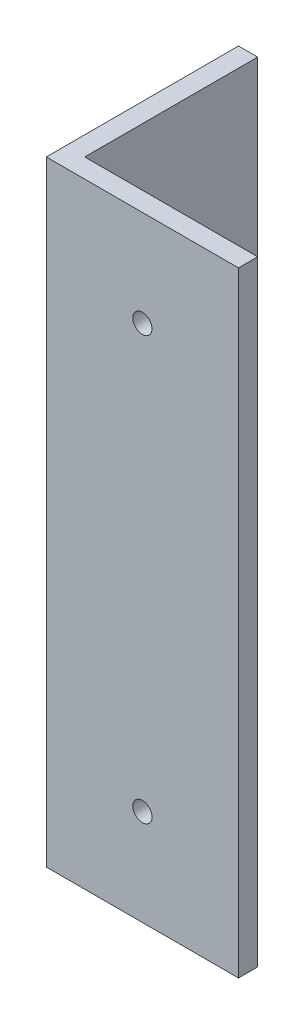
from build123d import *

# Parameters (mm, degrees)
BOSS_EXTRUDE1_DEPTH = 80
SKETCH2_R           = 2.5
CUT_EXTRUDE1_DEPTH  = 107.77078252
SKETCH3_R           = 2.5
CUT_EXTRUDE2_DEPTH  = 107.77078252


with BuildPart() as part:
    # Sketch1 → Boss-Extrude1 (new, symmetric)
    with BuildSketch(Plane(origin=(0, 0, 0), x_dir=(1, 0, 0), z_dir=(0, 1, 0))):
        Polygon((0, 0), (0, 50), (5, 50), (5, 5), (50, 5), (50, 0), align=None)
    extrude(amount=BOSS_EXTRUDE1_DEPTH, both=True)

    # Sketch2 → Cut-Extrude1 (cut, through all)
    with BuildSketch(Plane.XY):
        with Locations((25, 55)):
            Circle(SKETCH2_R)
        with Locations((25, -55)):
            Circle(SKETCH2_R)
    extrude(amount=-CUT_EXTRUDE1_DEPTH, mode=Mode.SUBTRACT)

    # Sketch3 → Cut-Extrude2 (cut, through all)
    with BuildSketch(Plane.ZY):
        with Locations((-25, 55)):
            Circle(SKETCH3_R)
        with Locations((-25, -55)):
            Circle(SKETCH3_R)
    extrude(amount=-CUT_EXTRUDE2_DEPTH, mode=Mode.SUBTRACT)


solid = part.part
